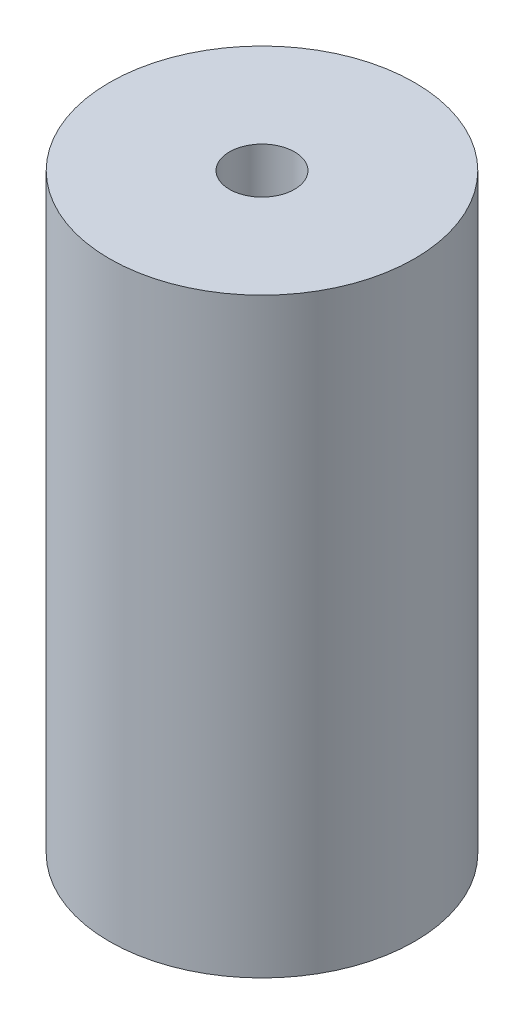
from build123d import *

# Parameters (mm, degrees)
SKETCH1_R           = 38.71
SKETCH1_R_2         = 8.25
BOSS_EXTRUDE1_DEPTH = 150


with BuildPart() as part:
    # Sketch1 → Boss-Extrude1 (new body)
    with BuildSketch(Plane(origin=(0, 0, 0), x_dir=(1, 0, 0), z_dir=(0, 1, 0))):
        with Locations(Location((0, 0, 0), (0, 0, 270))):
            Circle(SKETCH1_R)
        with Locations(Location((0, 0, 0), (0, 0, 270))):
            Circle(SKETCH1_R_2, mode=Mode.SUBTRACT)
    extrude(amount=BOSS_EXTRUDE1_DEPTH)


solid = part.part
